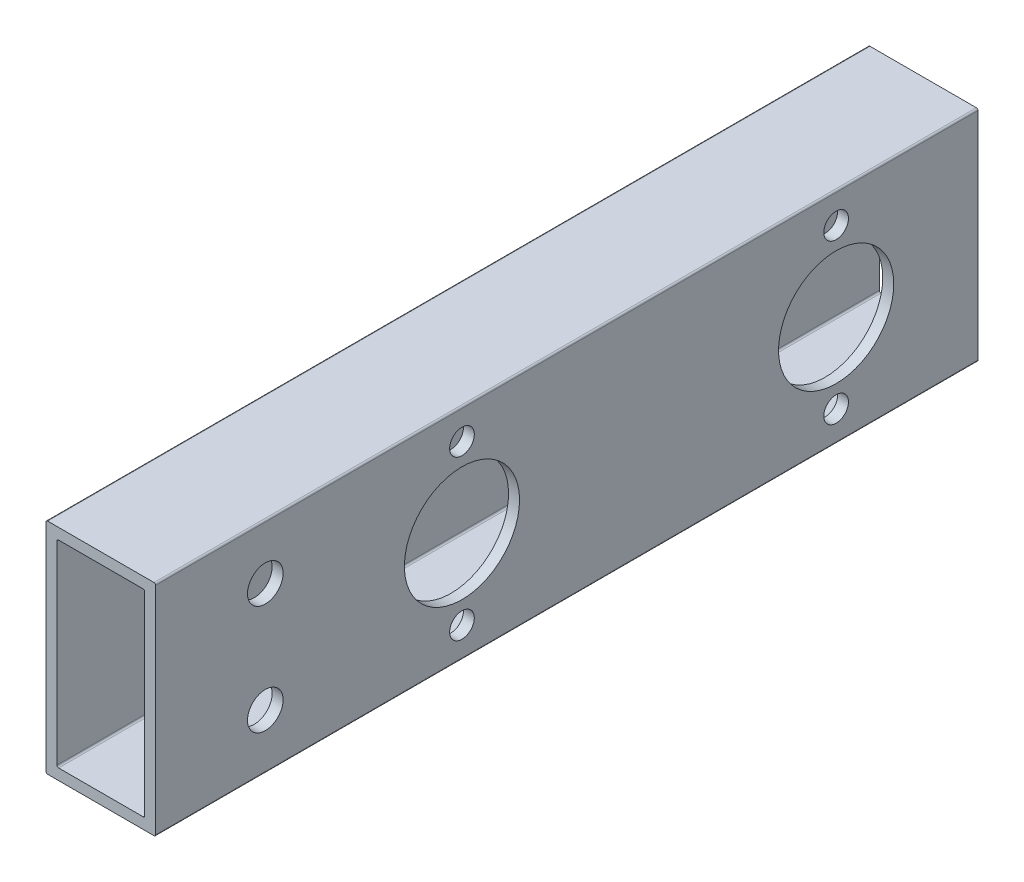
from build123d import *

# Parameters (mm, degrees)
EXTRUDE_1_DEPTH     = 150
SKETCH_2_R          = 3.25
CUT_EXTRUDE_1_DEPTH = 157.524758425
SKETCH_3_R          = 10.5
CUT_EXTRUDE_2_DEPTH = 157.524758425
SKETCH_4_R          = 10.5
CUT_EXTRUDE_3_DEPTH = 157.524758425
SKETCH_5_R          = 2.25
CUT_EXTRUDE_4_DEPTH = 10
SKETCH_5_4_R        = 2.25
CUT_EXTRUDE_5_DEPTH = 10


with BuildPart() as part:
    # ｽｹｯﾁ1 → ﾎﾞｽ - 押し出し1 (new body)
    with BuildSketch(Plane.XY):
        with BuildLine():
            Line((0.3, 0), (19.7, 0))
            ThreePointArc((19.7, 0), (19.912132034, 0.087867966), (20, 0.3))
            Line((20, 0.3), (20, 39.7))
            ThreePointArc((20, 39.7), (19.912132034, 39.912132034), (19.7, 40))
            Line((19.7, 40), (0.3, 40))
            ThreePointArc((0.3, 40), (0.087867966, 39.912132034), (0, 39.7))
            Line((0, 39.7), (0, 0.3))
            ThreePointArc((0, 0.3), (0.087867966, 0.087867966), (0.3, 0))
        make_face()
        with BuildLine():
            Line((2.3, 2), (17.7, 2))
            ThreePointArc((17.7, 2), (17.912132034, 2.087867966), (18, 2.3))
            Line((18, 2.3), (18, 37.7))
            ThreePointArc((18, 37.7), (17.912132034, 37.912132034), (17.7, 38))
            Line((17.7, 38), (2.3, 38))
            ThreePointArc((2.3, 38), (2.087867966, 37.912132034), (2, 37.7))
            Line((2, 37.7), (2, 2.3))
            ThreePointArc((2, 2.3), (2.087867966, 2.087867966), (2.3, 2))
        make_face(mode=Mode.SUBTRACT)
    extrude(amount=-EXTRUDE_1_DEPTH)

    # ｽｹｯﾁ2 → ｶｯﾄ - 押し出し1 (cut, through all)
    with BuildSketch(Plane.ZY):
        with Locations((-20, 30)):
            Circle(SKETCH_2_R)
        with Locations((-20, 10)):
            Circle(SKETCH_2_R)
    extrude(amount=-CUT_EXTRUDE_1_DEPTH, mode=Mode.SUBTRACT)

    # ｽｹｯﾁ3 → ｶｯﾄ - 押し出し2 (cut, through all)
    with BuildSketch(Plane(origin=(20, 0, 0), x_dir=(0, 0, -1), z_dir=(1, 0, 0))):
        with Locations((124.125, 20)):
            Circle(SKETCH_3_R)
    extrude(amount=-CUT_EXTRUDE_2_DEPTH, mode=Mode.SUBTRACT)

    # ｽｹｯﾁ4 → ｶｯﾄ - 押し出し3 (cut, through all)
    with BuildSketch(Plane(origin=(20, 0, 0), x_dir=(0, 0, -1), z_dir=(1, 0, 0))):
        with Locations((55.875, 20)):
            Circle(SKETCH_4_R)
    extrude(amount=-CUT_EXTRUDE_3_DEPTH, mode=Mode.SUBTRACT)

    # ｽｹｯﾁ5 → ｶｯﾄ - 押し出し4 (cut)
    with BuildSketch(Plane(origin=(20, 0, 0), x_dir=(0, 0, -1), z_dir=(1, 0, 0))):
        with Locations((124.125, 5.5)):
            Circle(SKETCH_5_R)
    extrude(amount=-CUT_EXTRUDE_4_DEPTH, mode=Mode.SUBTRACT)

    # ｽｹｯﾁ5<4> → ｶｯﾄ - 押し出し5 (cut)
    with BuildSketch(Plane(origin=(20, 0, 0), x_dir=(0, 0, -1), z_dir=(1, 0, 0))):
        with Locations((55.875, 34.5)):
            Circle(SKETCH_5_4_R)
        with Locations((55.875, 5.5)):
            Circle(SKETCH_5_4_R)
        with Locations((124.125, 5.5)):
            Circle(SKETCH_5_4_R)
        with Locations((124.125, 34.5)):
            Circle(SKETCH_5_4_R)
    extrude(amount=-CUT_EXTRUDE_5_DEPTH, mode=Mode.SUBTRACT)


solid = part.part
